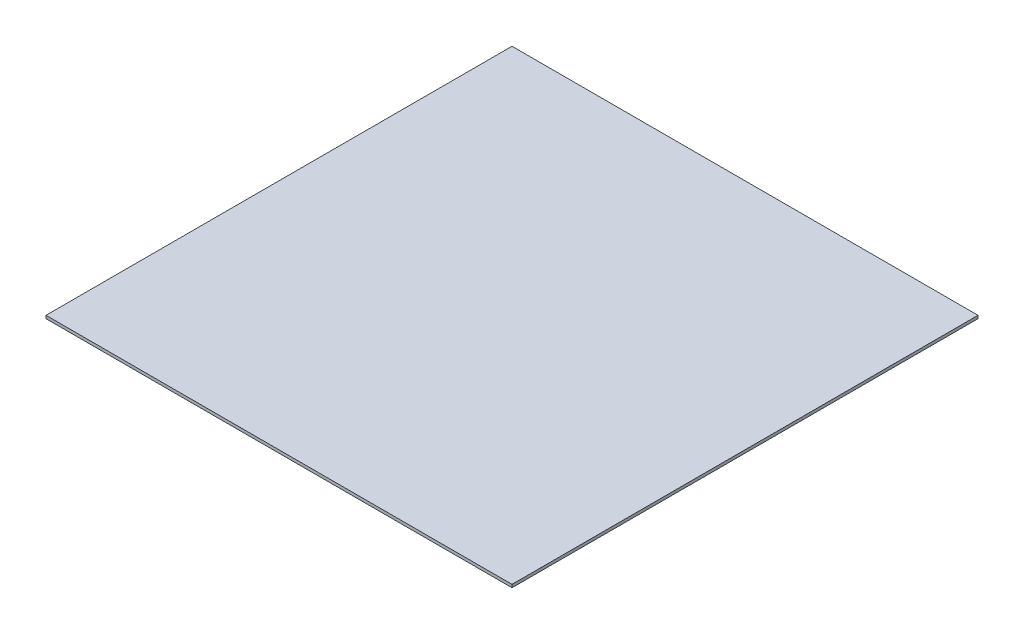
from build123d import *

# Parameters (mm, degrees)
SKETCH1_W           = 1000
SKETCH1_H           = 1000
BOSS_EXTRUDE1_DEPTH = 6.35


with BuildPart() as part:
    # Sketch1 → Boss-Extrude1 (new body)
    with BuildSketch(Plane(origin=(0, 0, 0), x_dir=(1, 0, 0), z_dir=(0, 1, 0))):
        with Locations((500, 500)):
            Rectangle(SKETCH1_W, SKETCH1_H)
    extrude(amount=BOSS_EXTRUDE1_DEPTH)


solid = part.part
